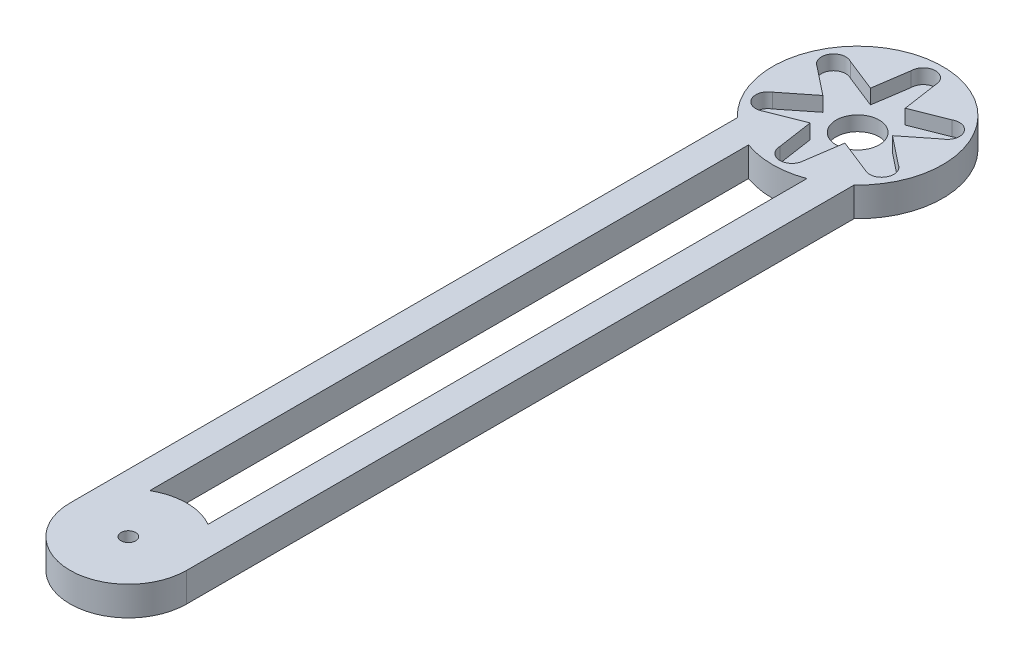
from build123d import *

# Parameters (mm, degrees)
SKETCH1_R           = 17.5
BOSS_EXTRUDE3_DEPTH = 6
BOSS_EXTRUDE5_DEPTH = 3
SKETCH2_R           = 1.5
BOSS_EXTRUDE6_DEPTH = 6


with BuildPart() as part:
    # Sketch1 → Boss-Extrude3 (new body)
    with BuildSketch(Plane(origin=(0, 0, 0), x_dir=(1, 0, 0), z_dir=(0, 1, 0))):
        with Locations(Location((0, 0, 0), (0, 0, 270))):
            Circle(SKETCH1_R)
        with BuildLine():
            ThreePointArc((-2.5, 13.5), (-1.767766953, 15.267766953), (0, 16))
            ThreePointArc((0, 16), (1.767766953, 15.267766953), (2.5, 13.5))
            Line((2.5, 13.5), (3.581091494, 6.202632414))
            Line((3.581091494, 6.202632414), (10.441342951, 8.915063509))
            ThreePointArc((10.441342951, 8.915063509), (12.338390564, 9.164814566), (13.856406461, 8))
            ThreePointArc((13.856406461, 8), (14.106157517, 7.397047613), (14.191342951, 6.75))
            ThreePointArc((14.191342951, 6.75), (13.856406461, 5.5), (12.941342951, 4.584936491))
            Line((12.941342951, 4.584936491), (7.162182988, 0))
            Line((7.162182988, 0), (12.941342951, -4.584936491))
            ThreePointArc((12.941342951, -4.584936491), (13.856406461, -5.5), (14.191342951, -6.75))
            ThreePointArc((14.191342951, -6.75), (14.106157517, -7.397047613), (13.856406461, -8))
            ThreePointArc((13.856406461, -8), (12.338390564, -9.164814566), (10.441342951, -8.915063509))
            Line((10.441342951, -8.915063509), (3.581091494, -6.202632414))
            Line((3.581091494, -6.202632414), (2.5, -13.5))
            ThreePointArc((2.5, -13.5), (1.767766953, -15.267766953), (0, -16))
            ThreePointArc((0, -16), (-1.767766953, -15.267766953), (-2.5, -13.5))
            Line((-2.5, -13.5), (-3.581091494, -6.202632414))
            Line((-3.581091494, -6.202632414), (-10.441342951, -8.915063509))
            ThreePointArc((-10.441342951, -8.915063509), (-12.338390564, -9.164814566), (-13.856406461, -8))
            ThreePointArc((-13.856406461, -8), (-14.106157517, -6.102952387), (-12.941342951, -4.584936491))
            Line((-12.941342951, -4.584936491), (-7.162182988, 0))
            Line((-7.162182988, 0), (-12.941342951, 4.584936491))
            ThreePointArc((-12.941342951, 4.584936491), (-14.106157517, 6.102952387), (-13.856406461, 8))
            ThreePointArc((-13.856406461, 8), (-12.338390564, 9.164814566), (-10.441342951, 8.915063509))
            Line((-10.441342951, 8.915063509), (-3.581091494, 6.202632414))
            Line((-3.581091494, 6.202632414), (-2.5, 13.5))
        make_face(mode=Mode.SUBTRACT)
    extrude(amount=BOSS_EXTRUDE3_DEPTH)

    # Sketch1<11> → Boss-Extrude5 (add)
    with BuildSketch(Plane(origin=(0, 0, 0), x_dir=(1, 0, 0), z_dir=(0, 1, 0))):
        with BuildLine():
            ThreePointArc((-9.191342951, 6.75), (-9.526279442, 8), (-10.441342951, 8.915063509))
            Line((-10.441342951, 8.915063509), (-11.691342951, 6.75))
            Line((-11.691342951, 6.75), (-9.526279442, 5.5))
            ThreePointArc((-9.526279442, 5.5), (-9.276528385, 6.102952387), (-9.191342951, 6.75))
        make_face()
        with BuildLine():
            Line((-11.691342951, 6.75), (-10.441342951, 8.915063509))
            ThreePointArc((-10.441342951, 8.915063509), (-12.338390564, 9.164814566), (-13.856406461, 8))
            Line((-13.856406461, 8), (-11.691342951, 6.75))
        make_face()
        with BuildLine():
            ThreePointArc((-12.941342951, 4.584936491), (-11.044295338, 4.335185434), (-9.526279442, 5.5))
            Line((-9.526279442, 5.5), (-11.691342951, 6.75))
            Line((-11.691342951, 6.75), (-12.941342951, 4.584936491))
        make_face()
        with BuildLine():
            Line((-12.941342951, 4.584936491), (-11.691342951, 6.75))
            Line((-11.691342951, 6.75), (-13.856406461, 8))
            ThreePointArc((-13.856406461, 8), (-14.106157517, 6.102952387), (-12.941342951, 4.584936491))
        make_face()
        with BuildLine():
            Line((-4.145427594, 2.393363738), (-3.581091494, 6.202632414))
            Line((-3.581091494, 6.202632414), (-10.441342951, 8.915063509))
            ThreePointArc((-10.441342951, 8.915063509), (-9.526279442, 8), (-9.191342951, 6.75))
            ThreePointArc((-9.191342951, 6.75), (-9.276528385, 6.102952387), (-9.526279442, 5.5))
            Line((-9.526279442, 5.5), (-4.145427594, 2.393363738))
        make_face()
        with BuildLine():
            Line((-7.162182988, 0), (-4.145427594, 2.393363738))
            Line((-4.145427594, 2.393363738), (-9.526279442, 5.5))
            ThreePointArc((-9.526279442, 5.5), (-11.044295338, 4.335185434), (-12.941342951, 4.584936491))
            Line((-12.941342951, 4.584936491), (-7.162182988, 0))
        make_face()
        Polygon((-2.25, 3.897114317), (0, 4.786727475), (-3.581091494, 6.202632414), (-4.145427594, 2.393363738), align=None)
        with BuildLine():
            Line((-3.832162412, 2.2125), (-4.145427594, 2.393363738))
            Line((-4.145427594, 2.393363738), (-4.5, 0))
            Line((-4.5, 0), (-4.145427594, -2.393363738))
            Line((-4.145427594, -2.393363738), (-3.832162412, -2.2125))
            ThreePointArc((-3.832162412, -2.2125), (-4.425, 0), (-3.832162412, 2.2125))
        make_face()
        with BuildLine():
            Line((0, 4.425), (0, 4.786727475))
            Line((0, 4.786727475), (-2.25, 3.897114317))
            Line((-2.25, 3.897114317), (-4.145427594, 2.393363738))
            Line((-4.145427594, 2.393363738), (-3.832162412, 2.2125))
            ThreePointArc((-3.832162412, 2.2125), (-2.2125, 3.832162412), (0, 4.425))
        make_face()
        Polygon((-4.5, 0), (-4.145427594, 2.393363738), (-7.162182988, 0), (-4.145427594, -2.393363738), align=None)
        with BuildLine():
            Line((-4.145427594, -2.393363738), (-7.162182988, 0))
            Line((-7.162182988, 0), (-12.941342951, -4.584936491))
            ThreePointArc((-12.941342951, -4.584936491), (-11.044295338, -4.335185434), (-9.526279442, -5.5))
            Line((-9.526279442, -5.5), (-4.145427594, -2.393363738))
        make_face()
        with BuildLine():
            ThreePointArc((-9.526279442, -5.5), (-11.044295338, -4.335185434), (-12.941342951, -4.584936491))
            Line((-12.941342951, -4.584936491), (-11.691342951, -6.75))
            Line((-11.691342951, -6.75), (-9.526279442, -5.5))
        make_face()
        with BuildLine():
            Line((-11.691342951, -6.75), (-12.941342951, -4.584936491))
            ThreePointArc((-12.941342951, -4.584936491), (-14.106157517, -6.102952387), (-13.856406461, -8))
            Line((-13.856406461, -8), (-11.691342951, -6.75))
        make_face()
        with BuildLine():
            ThreePointArc((-9.191342951, -6.75), (-9.276528385, -6.102952387), (-9.526279442, -5.5))
            Line((-9.526279442, -5.5), (-11.691342951, -6.75))
            Line((-11.691342951, -6.75), (-10.441342951, -8.915063509))
            ThreePointArc((-10.441342951, -8.915063509), (-9.526279442, -8), (-9.191342951, -6.75))
        make_face()
        with BuildLine():
            Line((-10.441342951, -8.915063509), (-11.691342951, -6.75))
            Line((-11.691342951, -6.75), (-13.856406461, -8))
            ThreePointArc((-13.856406461, -8), (-12.338390564, -9.164814566), (-10.441342951, -8.915063509))
        make_face()
        with BuildLine():
            Line((-3.581091494, -6.202632414), (-4.145427594, -2.393363738))
            Line((-4.145427594, -2.393363738), (-9.526279442, -5.5))
            ThreePointArc((-9.526279442, -5.5), (-9.276528385, -6.102952387), (-9.191342951, -6.75))
            ThreePointArc((-9.191342951, -6.75), (-9.526279442, -8), (-10.441342951, -8.915063509))
            Line((-10.441342951, -8.915063509), (-3.581091494, -6.202632414))
        make_face()
        with BuildLine():
            Line((0, -4.786727475), (0, -4.425))
            ThreePointArc((0, -4.425), (-2.2125, -3.832162412), (-3.832162412, -2.2125))
            Line((-3.832162412, -2.2125), (-4.145427594, -2.393363738))
            Line((-4.145427594, -2.393363738), (-2.25, -3.897114317))
            Line((-2.25, -3.897114317), (0, -4.786727475))
        make_face()
        Polygon((-2.25, -3.897114317), (-4.145427594, -2.393363738), (-3.581091494, -6.202632414), (0, -4.786727475), align=None)
        with BuildLine():
            Line((0, -11), (0, -4.786727475))
            Line((0, -4.786727475), (-3.581091494, -6.202632414))
            Line((-3.581091494, -6.202632414), (-2.5, -13.5))
            ThreePointArc((-2.5, -13.5), (-1.767766953, -11.732233047), (0, -11))
        make_face()
        with BuildLine():
            Line((3.581091494, -6.202632414), (0, -4.786727475))
            Line((0, -4.786727475), (0, -11))
            ThreePointArc((0, -11), (1.767766953, -11.732233047), (2.5, -13.5))
            Line((2.5, -13.5), (3.581091494, -6.202632414))
        make_face()
        with BuildLine():
            Line((4.145427594, -2.393363738), (3.832162412, -2.2125))
            ThreePointArc((3.832162412, -2.2125), (2.2125, -3.832162412), (0, -4.425))
            Line((0, -4.425), (0, -4.786727475))
            Line((0, -4.786727475), (2.25, -3.897114317))
            Line((2.25, -3.897114317), (4.145427594, -2.393363738))
        make_face()
        Polygon((3.581091494, -6.202632414), (4.145427594, -2.393363738), (2.25, -3.897114317), (0, -4.786727475), align=None)
        with BuildLine():
            Line((0, -13.5), (0, -11))
            ThreePointArc((0, -11), (-1.767766953, -11.732233047), (-2.5, -13.5))
            Line((-2.5, -13.5), (0, -13.5))
        make_face()
        with BuildLine():
            Line((0, -13.5), (-2.5, -13.5))
            ThreePointArc((-2.5, -13.5), (-1.767766953, -15.267766953), (0, -16))
            Line((0, -16), (0, -13.5))
        make_face()
        with BuildLine():
            ThreePointArc((2.5, -13.5), (1.767766953, -11.732233047), (0, -11))
            Line((0, -11), (0, -13.5))
            Line((0, -13.5), (2.5, -13.5))
        make_face()
        with BuildLine():
            ThreePointArc((0, -16), (1.767766953, -15.267766953), (2.5, -13.5))
            Line((2.5, -13.5), (0, -13.5))
            Line((0, -13.5), (0, -16))
        make_face()
        with BuildLine():
            Line((9.526279442, -5.5), (4.145427594, -2.393363738))
            Line((4.145427594, -2.393363738), (3.581091494, -6.202632414))
            Line((3.581091494, -6.202632414), (10.441342951, -8.915063509))
            ThreePointArc((10.441342951, -8.915063509), (9.276528385, -7.397047613), (9.526279442, -5.5))
        make_face()
        with BuildLine():
            Line((11.691342951, -6.75), (9.526279442, -5.5))
            ThreePointArc((9.526279442, -5.5), (9.276528385, -7.397047613), (10.441342951, -8.915063509))
            Line((10.441342951, -8.915063509), (11.691342951, -6.75))
        make_face()
        with BuildLine():
            Line((13.856406461, -8), (11.691342951, -6.75))
            Line((11.691342951, -6.75), (10.441342951, -8.915063509))
            ThreePointArc((10.441342951, -8.915063509), (12.338390564, -9.164814566), (13.856406461, -8))
        make_face()
        with BuildLine():
            ThreePointArc((14.191342951, -6.75), (13.856406461, -5.5), (12.941342951, -4.584936491))
            Line((12.941342951, -4.584936491), (11.691342951, -6.75))
            Line((11.691342951, -6.75), (13.856406461, -8))
            ThreePointArc((13.856406461, -8), (14.106157517, -7.397047613), (14.191342951, -6.75))
        make_face()
        with BuildLine():
            Line((11.691342951, -6.75), (12.941342951, -4.584936491))
            ThreePointArc((12.941342951, -4.584936491), (11.044295338, -4.335185434), (9.526279442, -5.5))
            Line((9.526279442, -5.5), (11.691342951, -6.75))
        make_face()
        with BuildLine():
            Line((12.941342951, -4.584936491), (7.162182988, 0))
            Line((7.162182988, 0), (4.145427594, -2.393363738))
            Line((4.145427594, -2.393363738), (9.526279442, -5.5))
            ThreePointArc((9.526279442, -5.5), (11.044295338, -4.335185434), (12.941342951, -4.584936491))
        make_face()
        with BuildLine():
            Line((4.5, 0), (4.145427594, 2.393363738))
            Line((4.145427594, 2.393363738), (3.832162412, 2.2125))
            ThreePointArc((3.832162412, 2.2125), (4.274221781, 1.145274275), (4.425, 0))
            ThreePointArc((4.425, 0), (4.274221781, -1.145274275), (3.832162412, -2.2125))
            Line((3.832162412, -2.2125), (4.145427594, -2.393363738))
            Line((4.145427594, -2.393363738), (4.5, 0))
        make_face()
        Polygon((7.162182988, 0), (4.145427594, 2.393363738), (4.5, 0), (4.145427594, -2.393363738), align=None)
        with BuildLine():
            Line((9.526279442, 5.5), (4.145427594, 2.393363738))
            Line((4.145427594, 2.393363738), (7.162182988, 0))
            Line((7.162182988, 0), (12.941342951, 4.584936491))
            ThreePointArc((12.941342951, 4.584936491), (11.044295338, 4.335185434), (9.526279442, 5.5))
        make_face()
        with BuildLine():
            Line((2.25, 3.897114317), (0, 4.786727475))
            Line((0, 4.786727475), (0, 4.425))
            ThreePointArc((0, 4.425), (2.2125, 3.832162412), (3.832162412, 2.2125))
            Line((3.832162412, 2.2125), (4.145427594, 2.393363738))
            Line((4.145427594, 2.393363738), (2.25, 3.897114317))
        make_face()
        Polygon((3.581091494, 6.202632414), (0, 4.786727475), (2.25, 3.897114317), (4.145427594, 2.393363738), align=None)
        with BuildLine():
            Line((10.441342951, 8.915063509), (3.581091494, 6.202632414))
            Line((3.581091494, 6.202632414), (4.145427594, 2.393363738))
            Line((4.145427594, 2.393363738), (9.526279442, 5.5))
            ThreePointArc((9.526279442, 5.5), (9.276528385, 7.397047613), (10.441342951, 8.915063509))
        make_face()
        with BuildLine():
            ThreePointArc((13.856406461, 8), (12.338390564, 9.164814566), (10.441342951, 8.915063509))
            Line((10.441342951, 8.915063509), (11.691342951, 6.75))
            Line((11.691342951, 6.75), (13.856406461, 8))
        make_face()
        with BuildLine():
            Line((11.691342951, 6.75), (10.441342951, 8.915063509))
            ThreePointArc((10.441342951, 8.915063509), (9.276528385, 7.397047613), (9.526279442, 5.5))
            Line((9.526279442, 5.5), (11.691342951, 6.75))
        make_face()
        with BuildLine():
            Line((11.691342951, 6.75), (9.526279442, 5.5))
            ThreePointArc((9.526279442, 5.5), (11.044295338, 4.335185434), (12.941342951, 4.584936491))
            Line((12.941342951, 4.584936491), (11.691342951, 6.75))
        make_face()
        with BuildLine():
            Line((13.856406461, 8), (11.691342951, 6.75))
            Line((11.691342951, 6.75), (12.941342951, 4.584936491))
            ThreePointArc((12.941342951, 4.584936491), (13.856406461, 5.5), (14.191342951, 6.75))
            ThreePointArc((14.191342951, 6.75), (14.106157517, 7.397047613), (13.856406461, 8))
        make_face()
        with BuildLine():
            ThreePointArc((2.5, 13.5), (1.767766953, 11.732233047), (0, 11))
            Line((0, 11), (0, 4.786727475))
            Line((0, 4.786727475), (3.581091494, 6.202632414))
            Line((3.581091494, 6.202632414), (2.5, 13.5))
        make_face()
        with BuildLine():
            Line((0, 4.786727475), (0, 11))
            ThreePointArc((0, 11), (-1.767766953, 11.732233047), (-2.5, 13.5))
            Line((-2.5, 13.5), (-3.581091494, 6.202632414))
            Line((-3.581091494, 6.202632414), (0, 4.786727475))
        make_face()
        with BuildLine():
            Line((-2.5, 13.5), (0, 13.5))
            Line((0, 13.5), (0, 16))
            ThreePointArc((0, 16), (-1.767766953, 15.267766953), (-2.5, 13.5))
        make_face()
        with BuildLine():
            Line((0, 11), (0, 13.5))
            Line((0, 13.5), (-2.5, 13.5))
            ThreePointArc((-2.5, 13.5), (-1.767766953, 11.732233047), (0, 11))
        make_face()
        with BuildLine():
            Line((2.5, 13.5), (0, 13.5))
            Line((0, 13.5), (0, 11))
            ThreePointArc((0, 11), (1.767766953, 11.732233047), (2.5, 13.5))
        make_face()
        with BuildLine():
            Line((0, 16), (0, 13.5))
            Line((0, 13.5), (2.5, 13.5))
            ThreePointArc((2.5, 13.5), (1.767766953, 15.267766953), (0, 16))
        make_face()
    extrude(amount=BOSS_EXTRUDE5_DEPTH)

    # Sketch2 → Boss-Extrude6 (add)
    # profile 1 of 5: a face of its own
    with BuildSketch(Plane.XZ):
        with BuildLine():
            ThreePointArc((6, 16.439282223), (9.188327116, 14.893778729), (12, 12.737739203))
            Line((12, 12.737739203), (12, 150))
            ThreePointArc((12, 150), (10.392304845, 144), (6, 139.607695155))
            Line((6, 139.607695155), (6, 16.439282223))
        make_face()
    # profile 2 of 5: a face of its own
    with BuildSketch(Plane.XZ):
        with BuildLine():
            Line((-12, 150), (-12, 12.737739203))
            ThreePointArc((-12, 12.737739203), (-9.188327116, 14.893778729), (-6, 16.439282223))
            Line((-6, 16.439282223), (-6, 139.607695155))
            ThreePointArc((-6, 139.607695155), (-10.392304845, 144), (-12, 150))
        make_face()
    # profile 3 of 5: a face of its own
    with BuildSketch(Plane.XZ):
        with BuildLine():
            ThreePointArc((12, 150), (0, 162), (-12, 150))
            Line((-12, 150), (-6, 150))
            Line((-6, 150), (-6, 139.607695155))
            ThreePointArc((-6, 139.607695155), (0, 138), (6, 139.607695155))
            Line((6, 139.607695155), (6, 150))
            Line((6, 150), (12, 150))
        make_face()
        with Locations(Location((0, 150, 0), (0, 0, 270))):
            Circle(SKETCH2_R, mode=Mode.SUBTRACT)
    # profile 4 of 5: a face of its own
    with BuildSketch(Plane.XZ):
        with BuildLine():
            ThreePointArc((6, 139.607695155), (10.392304845, 144), (12, 150))
            Line((12, 150), (6, 150))
            Line((6, 150), (6, 139.607695155))
        make_face()
    # profile 5 of 5: a face of its own
    with BuildSketch(Plane.XZ):
        with BuildLine():
            Line((-6, 150), (-12, 150))
            ThreePointArc((-12, 150), (-10.392304845, 144), (-6, 139.607695155))
            Line((-6, 139.607695155), (-6, 150))
        make_face()
    extrude(amount=-BOSS_EXTRUDE6_DEPTH)


solid = part.part
